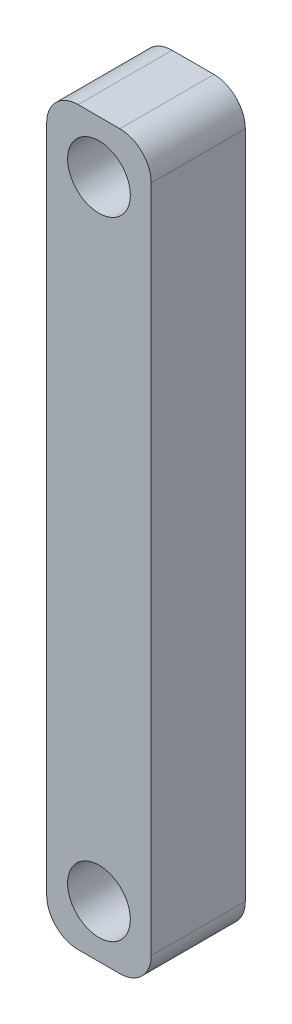
from build123d import *

# Parameters (mm, degrees)
SKETCH1_W          = 25.4
SKETCH1_H          = 177.8
BASE_EXTRUDE_DEPTH = 22.86
SKETCH2_R          = 7.62
CUT_EXTRUDE1_DEPTH = 78.74
FILLET1_R          = 7.62


with BuildPart() as part:
    # Sketch1 → Base-Extrude (new body)
    with BuildSketch(Plane.XY):
        with Locations((-7.849662618, -19.144264507)):
            Rectangle(SKETCH1_W, SKETCH1_H)
    extrude(amount=BASE_EXTRUDE_DEPTH)

    # Sketch2 → Cut-Extrude1 (cut)
    with BuildSketch(Plane.XY.offset(22.86)):
        with Locations((-7.849662618, -95.344264507)):
            Circle(SKETCH2_R)
        with Locations((-7.849662618, 57.055735493)):
            Circle(SKETCH2_R)
    extrude(amount=-CUT_EXTRUDE1_DEPTH, mode=Mode.SUBTRACT)

    # Fillet1
    fillet1_edges = [part.edges().sort_by_distance(p)[0] for p in [
        (-20.549662618, 69.755735493, 11.43),
        (4.850337382, 69.755735493, 11.43),
        (4.850337382, -108.044264507, 11.43),
        (-20.549662618, -108.044264507, 11.43),
    ]]
    fillet(fillet1_edges, radius=FILLET1_R)


solid = part.part
